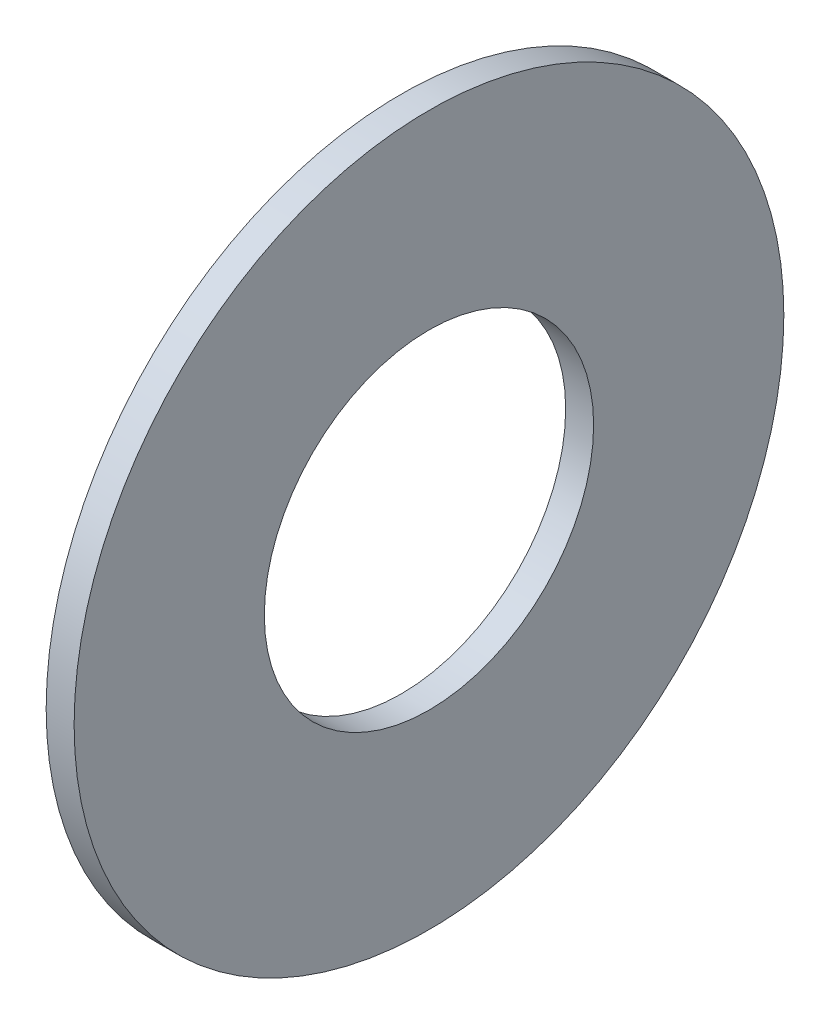
from build123d import *

# Parameters (mm, degrees)
SKETCH5_R           = 10.31875
SKETCH5_R_2         = 4.7879
BOSS_EXTRUDE1_DEPTH = 0.4064


with BuildPart() as part:
    # Sketch5 → Boss-Extrude1 (new, symmetric)
    with BuildSketch(Plane(origin=(0, 0, 0), x_dir=(0, 0, -1), z_dir=(1, 0, 0))):
        Circle(SKETCH5_R)
        Circle(SKETCH5_R_2, mode=Mode.SUBTRACT)
    extrude(amount=BOSS_EXTRUDE1_DEPTH, both=True)


solid = part.part
